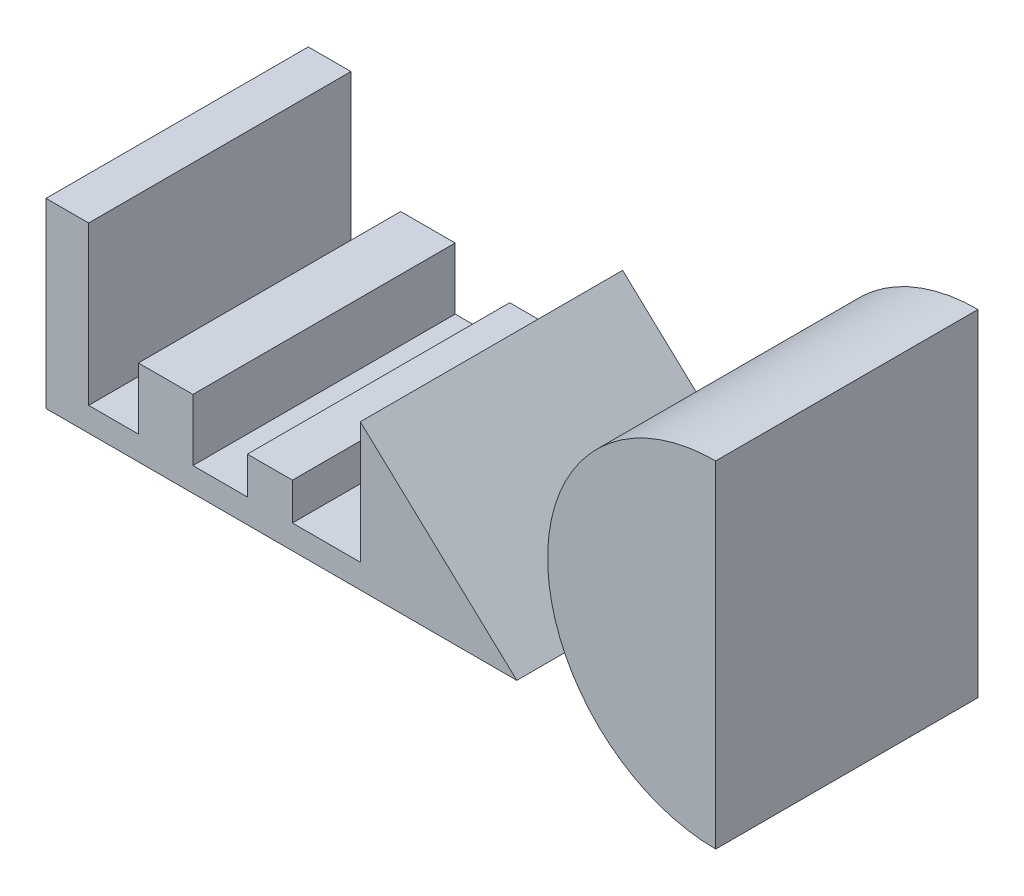
from build123d import *

# Parameters (mm, degrees)
BOSS_EXTRUDE1_DEPTH   = 190.5
BOSS_EXTRUDE1_2_DEPTH = 190.5


with BuildPart() as part:
    # Sketch1 → Boss-Extrude1 (new, symmetric)
    with BuildSketch(Plane.XY):
        Polygon((0, 0), (0, 264.438275148), (61.950832356, 264.438275148), (61.950832356, 34.990747905), (134.226803438, 34.990747905), (134.226803438, 124.47528353), (213.386200337, 124.47528353), (213.386200337, 34.990747905), (292.545597236, 34.990747905), (292.545597236, 88.910916807), (357.9381425, 88.910916807), (357.9381425, 34.990747905), (456.600579215, 34.990747905), (456.600579215, 211.665343882), (683.937189208, 0), align=None)
    extrude(amount=BOSS_EXTRUDE1_DEPTH, both=True)


with BuildPart() as body_2:
    # Sketch1 → Boss-Extrude1 2 (new, symmetric)
    with BuildSketch(Plane.XY):
        with BuildLine():
            Line((972.879836168, 420.603130604), (972.879836168, -67.762908332))
            ThreePointArc((972.879836168, -67.762908332), (728.696816701, 176.420111136), (972.879836168, 420.603130604))
        make_face()
    extrude(amount=BOSS_EXTRUDE1_2_DEPTH, both=True)


solid = Compound([part.part, body_2.part])
